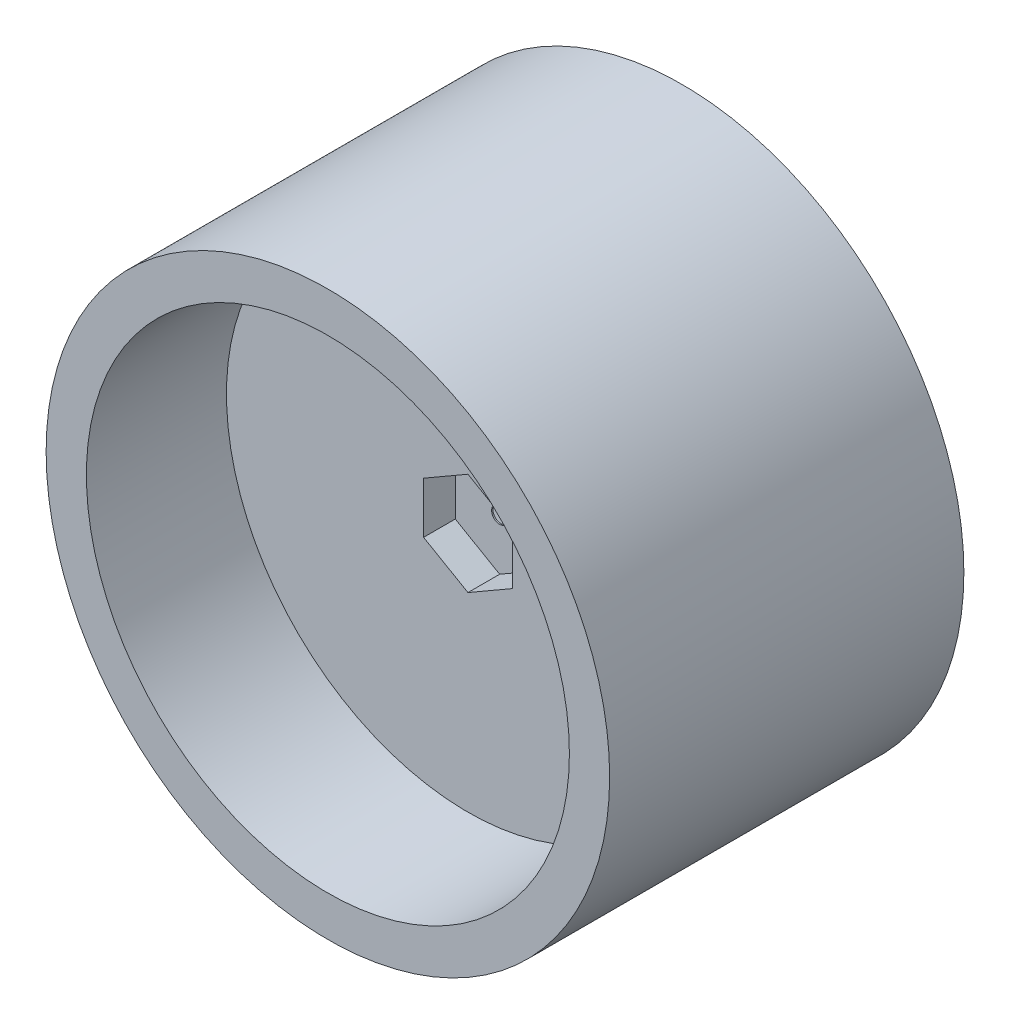
from build123d import *

# Parameters (mm, degrees)
SKETCH1_R           = 44.45
BOSS_EXTRUDE1_DEPTH = 55.88
SKETCH2_R           = 38.1
CUT_EXTRUDE1_DEPTH  = 22.098
CUT_EXTRUDE2_START  = -28.575
SKETCH3_R           = 38.1
CUT_EXTRUDE2_DEPTH  = 28.575
SKETCH4_R           = 1.27
CUT_EXTRUDE3_DEPTH  = 72.364056247
CUT_EXTRUDE4_DEPTH  = 5


with BuildPart() as part:
    # Sketch1 → Boss-Extrude1 (new body)
    with BuildSketch(Plane.XY):
        Circle(SKETCH1_R)
    extrude(amount=BOSS_EXTRUDE1_DEPTH)

    # Sketch2 → Cut-Extrude1 (cut)
    with BuildSketch(Plane.XY.offset(55.88)):
        Circle(SKETCH2_R)
    extrude(amount=-CUT_EXTRUDE1_DEPTH, mode=Mode.SUBTRACT)

    # Sketch3 → Cut-Extrude2 (cut)
    with BuildSketch(Plane(origin=(0, 0, 0), x_dir=(-1, 0, 0), z_dir=(0, 0, -1)).offset(CUT_EXTRUDE2_START)):
        with Locations(Location((0, 0, 0), (0, 0, 180))):
            Circle(SKETCH3_R)
    extrude(amount=CUT_EXTRUDE2_DEPTH, mode=Mode.SUBTRACT)

    # Sketch4 → Cut-Extrude3 (cut, through all)
    with BuildSketch(Plane.XY.offset(33.782)):
        Circle(SKETCH4_R)
    extrude(amount=-CUT_EXTRUDE3_DEPTH, mode=Mode.SUBTRACT)

    # Sketch5 → Cut-Extrude4 (cut)
    with BuildSketch(Plane.XY.offset(33.782)):
        Polygon((0, 8.082903769), (-7, 4.041451884), (-7, -4.041451884), (0, -8.082903769), (7, -4.041451884), (7, 4.041451884), align=None)
    extrude(amount=-CUT_EXTRUDE4_DEPTH, mode=Mode.SUBTRACT)


solid = part.part
